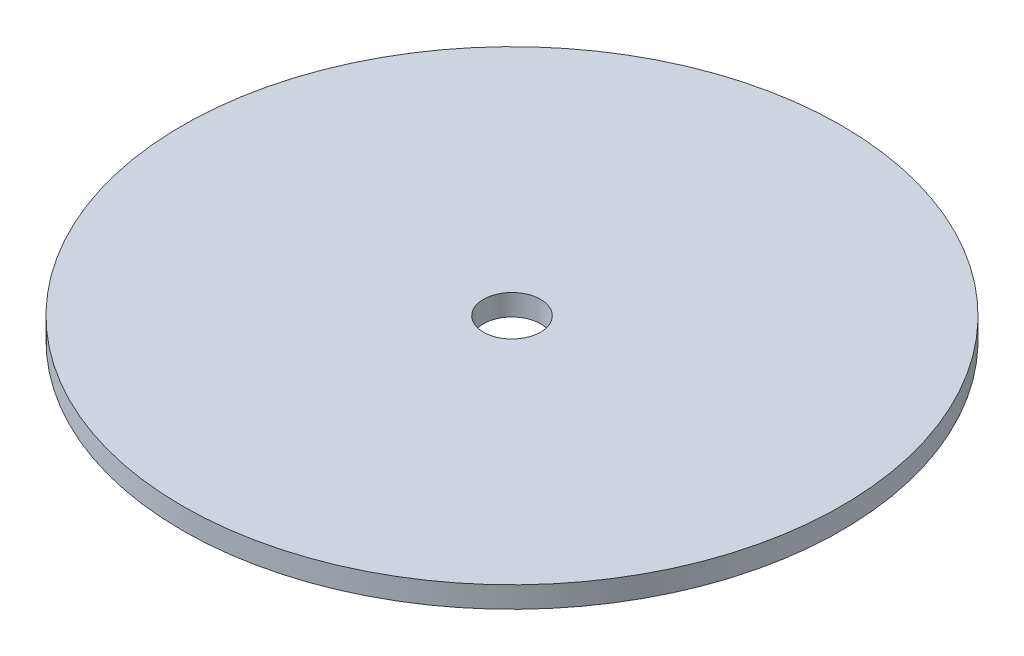
from build123d import *

# Parameters (mm, degrees)
SKETCH1_R           = 50
BOSS_EXTRUDE1_DEPTH = 3.22
SKETCH2_R           = 4.325
CUT_EXTRUDE1_DEPTH  = 4.63


with BuildPart() as part:
    # Sketch1 → Boss-Extrude1 (new body)
    with BuildSketch(Plane(origin=(0, 0, 0), x_dir=(1, 0, 0), z_dir=(0, 1, 0))):
        with Locations(Location((0, 0, 0), (0, 0, 90))):
            Circle(SKETCH1_R)
    extrude(amount=BOSS_EXTRUDE1_DEPTH)

    # Sketch2 → Cut-Extrude1 (cut)
    with BuildSketch(Plane(origin=(0, 3.22, 0), x_dir=(1, 0, 0), z_dir=(0, 1, 0))):
        with Locations(Location((0, 0, 0), (0, 0, 270))):
            Circle(SKETCH2_R)
    extrude(amount=-CUT_EXTRUDE1_DEPTH, mode=Mode.SUBTRACT)


solid = part.part
